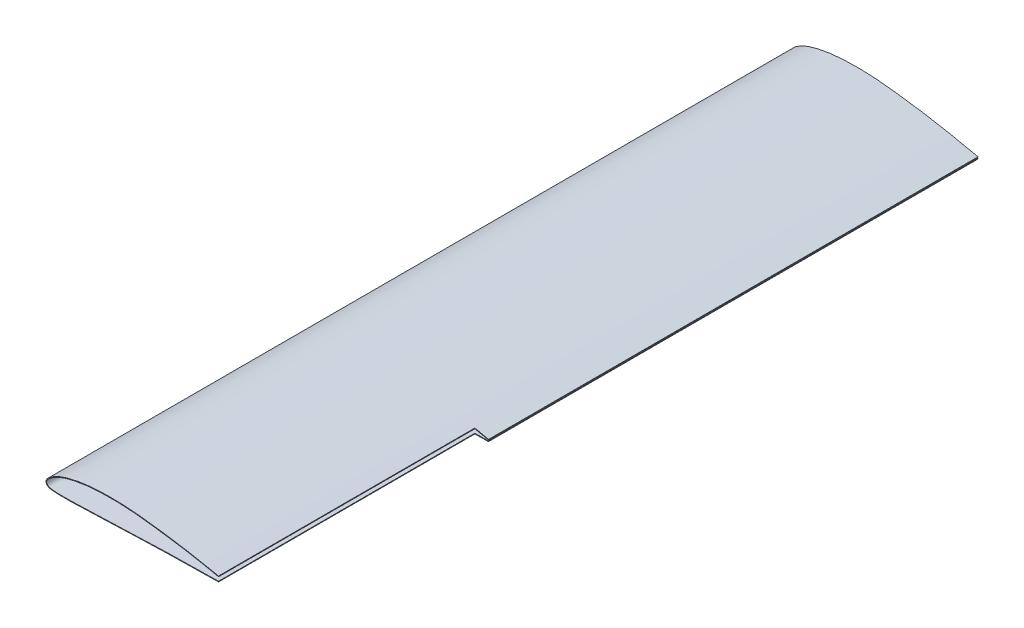
from build123d import *

# Parameters (mm, degrees)
EXTRUDE_1_DEPTH     = 1158
CUT_EXTRUDE_1_DEPTH = 398


with BuildPart() as part:
    # 草图2 → 凸台-拉伸1 (new body)
    with BuildSketch(Plane.XY):
        with BuildLine():
            Line((152.092237141, -4.009617787), (151.874543179, -4.985634866))
            add(Edge.make_bspline(
                [(151.874543179, -4.985634866), (139.831857624, -2.299595882), (121.736097334, 1.595739429), (97.52279115, 6.350905691), (79.323021772, 9.677033279), (61.057416738, 12.569669501), (42.725114525, 15.122267583), (24.377705861, 17.55673392), (6.002435448, 19.67131008), (-12.413217762, 21.241899181), (-30.870833249, 21.874085318), (-49.35363052, 21.628157324), (-64.72210946, 20.784643888), (-76.939594768, 19.424387181), (-86.044465732, 17.996227715), (-95.091513297, 16.19820704), (-102.543462484, 14.373041998), (-108.42810516, 12.643757606), (-112.763475735, 11.18156021), (-116.950627822, 9.406068462), (-121.046514832, 7.338032084), (-125.085160108, 5.144885721), (-128.985342491, 2.758514826), (-131.971777484, 0.514514819), (-134.025396382, -1.601262853), (-135.311630844, -3.331149981), (-136.156536256, -5.222311865), (-136.219555697, -7.067527657), (-135.379605451, -8.873466321), (-133.982317213, -10.402971749), (-132.271203821, -11.421236661), (-130.197889804, -11.907478815), (-127.9164222, -12.25671998), (-124.905484956, -12.644778535), (-121.105324462, -12.944543124), (-116.515931845, -13.063017705), (-111.893999304, -13.088829497), (-105.728076652, -13.082186755), (-98.018181852, -13.042617303), (-88.78864377, -12.823977334), (-79.545520854, -12.414871641), (-70.28480235, -12.044815131), (-61.028900265, -11.723596626), (-48.689458308, -11.317836312), (-33.272335925, -10.774983858), (-14.770831806, -10.049991649), (3.732379152, -9.29737087), (22.243070993, -8.605970543), (40.758717098, -8.024374117), (59.27793528, -7.576758162), (77.791126113, -7.182085159), (96.308539493, -6.789265162), (114.835719112, -6.54522408), (133.346397408, -6.372717872), (145.699314535, -6.214446164), (151.874543179, -6.19181804)],
                knots=[0.017978355, 0.017978355, 0.017978355, 0.017978355, 0.07823651, 0.108365588, 0.138494666, 0.168623744, 0.198752821, 0.228881899, 0.259010977, 0.289140055, 0.319269133, 0.349398211, 0.379527288, 0.394591827, 0.409656366, 0.424720905, 0.439785444, 0.447317713, 0.454849983, 0.462382252, 0.469914522, 0.477446791, 0.484979061, 0.49251133, 0.496277465, 0.5000436, 0.503809734, 0.507575869, 0.511342004, 0.515108139, 0.518874273, 0.522640408, 0.526406543, 0.530172677, 0.537704947, 0.545237216, 0.552769486, 0.560301755, 0.575366294, 0.590430833, 0.605495372, 0.620559911, 0.63562445, 0.650688989, 0.680818067, 0.710947144, 0.741076222, 0.7712053, 0.801334378, 0.831463456, 0.861592533, 0.891721611, 0.921850689, 0.951979767, 0.982108845, 0.982108845, 0.982108845, 0.982108845], degree=3))
            Line((151.874543179, -6.19181804), (151.878207493, -7.191811326))
            add(Edge.make_bspline(
                [(152.092237141, -4.009617787), (140.043208955, -1.322164122), (121.938945822, 2.574993054), (97.710136695, 7.333232052), (79.492150382, 10.662723456), (61.202227271, 13.559190093), (42.859736245, 16.11316641), (24.502746154, 18.548917856), (6.105268062, 20.666163179), (-12.351590501, 22.240428344), (-30.86237829, 22.874437864), (-46.29901601, 22.668981314), (-58.632035491, 22.120534031), (-67.867053798, 21.440716241), (-77.072274606, 20.41588358), (-86.220192188, 18.980933396), (-95.305866561, 17.17530937), (-102.800454025, 15.339772701), (-108.724592316, 13.599050146), (-113.11528795, 12.118697143), (-117.377698346, 10.311119657), (-121.511916057, 8.223288309), (-125.580648293, 6.013735119), (-129.536040509, 3.595137634), (-132.622806239, 1.278339619), (-134.783739525, -0.944145997), (-136.167116487, -2.805093477), (-137.147162334, -4.94035533), (-137.231902245, -7.304661817), (-136.208199492, -9.455669604), (-134.638492917, -11.179287672), (-132.621385534, -12.374195397), (-130.357560478, -12.894882012), (-128.058065356, -13.246682093), (-125.007225471, -13.640051871), (-121.152604522, -13.943889277), (-116.527334397, -14.062996556), (-111.89508162, -14.088831992), (-105.724762049, -14.082180515), (-98.006162648, -14.04261673), (-88.75190615, -13.823365059), (-79.500713664, -13.4138599), (-70.248343626, -13.044162149), (-60.995702222, -12.723043472), (-48.655996387, -12.317277328), (-33.234885761, -11.774290788), (-14.730260903, -11.049149248), (3.772036992, -10.296655945), (22.277768429, -9.605111823), (46.955987543, -8.831603973), (71.642118483, -8.3141441), (96.326568974, -7.788850677), (114.844631407, -7.545259964), (133.360193646, -7.372609403), (145.705446154, -7.214430409), (151.878207493, -7.191811326)],
                knots=[0.017978355, 0.017978355, 0.017978355, 0.017978355, 0.07823651, 0.108365588, 0.138494666, 0.168623744, 0.198752821, 0.228881899, 0.259010977, 0.289140055, 0.319269133, 0.349398211, 0.364462749, 0.379527288, 0.394591827, 0.409656366, 0.424720905, 0.439785444, 0.447317713, 0.454849983, 0.462382252, 0.469914522, 0.477446791, 0.484979061, 0.49251133, 0.496277465, 0.5000436, 0.503809734, 0.507575869, 0.511342004, 0.515108139, 0.518874273, 0.522640408, 0.526406543, 0.530172677, 0.537704947, 0.545237216, 0.552769486, 0.560301755, 0.575366294, 0.590430833, 0.605495372, 0.620559911, 0.63562445, 0.650688989, 0.680818067, 0.710947144, 0.741076222, 0.7712053, 0.801334378, 0.861592533, 0.891721611, 0.921850689, 0.951979767, 0.982108845, 0.982108845, 0.982108845, 0.982108845], degree=3))
        make_face()
    extrude(amount=EXTRUDE_1_DEPTH)

    # 草图3 → 切除-拉伸1 (cut)
    with BuildSketch(Plane.XY.offset(1158)):
        Polygon((130.787596038, -7.389756818), (169.392122262, -7.389756818), (130.787596038, 0.632587648), align=None)
    extrude(amount=-CUT_EXTRUDE_1_DEPTH, mode=Mode.SUBTRACT)


solid = part.part
